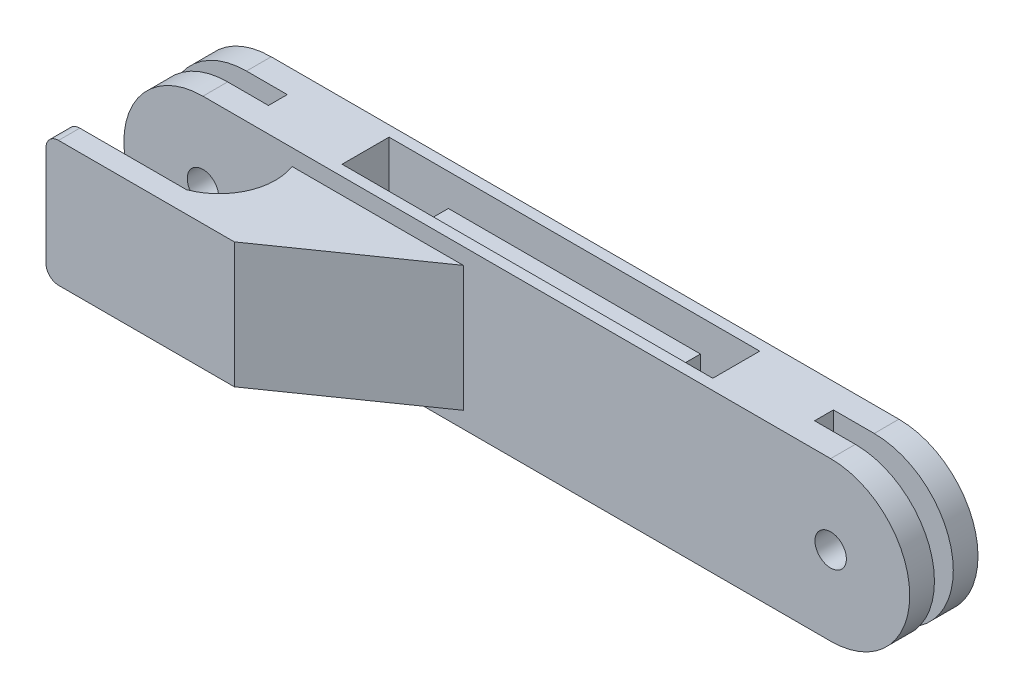
from build123d import *

# Parameters (mm, degrees)
SKETCH1_R           = 3.175
BOSS_EXTRUDE1_DEPTH = 5
SKETCH2_W           = 110.49
SKETCH2_H           = 15
BOSS_EXTRUDE2_DEPTH = 3.81
SKETCH5_R           = 3.175
BOSS_EXTRUDE3_DEPTH = 5
SKETCH6_W           = 75
SKETCH6_H           = 9.5
CUT_EXTRUDE1_DEPTH  = 6.5
SKETCH7_W           = 12
SKETCH7_H           = 9.5
CUT_EXTRUDE2_DEPTH  = 30.48
BOSS_EXTRUDE4_DEPTH = 19.05
CUT_EXTRUDE3_DEPTH  = 30.48
BOSS_EXTRUDE5_DEPTH = 25.4


with BuildPart() as part:
    # Sketch1 → Boss-Extrude1 (new body)
    with BuildSketch(Plane.XY):
        with BuildLine():
            Line((-47.217391304, 7.923913043), (79.782608696, 7.923913043))
            ThreePointArc((79.782608696, 7.923913043), (95.782608696, -8.076086957), (79.782608696, -24.076086957))
            Line((79.782608696, -24.076086957), (-47.217391304, -24.076086957))
            ThreePointArc((-47.217391304, -24.076086957), (-63.217391304, -8.076086957), (-47.217391304, 7.923913043))
        make_face()
        with Locations((-47.217391304, -8.076086957)):
            Circle(SKETCH1_R, mode=Mode.SUBTRACT)
        with Locations((79.782608696, -8.076086957)):
            Circle(SKETCH1_R, mode=Mode.SUBTRACT)
    extrude(amount=BOSS_EXTRUDE1_DEPTH)

    # Sketch2 → Boss-Extrude2 (add)
    with BuildSketch(Plane.XY.offset(5)):
        with Locations((16.282608696, 0.423913043)):
            Rectangle(SKETCH2_W, SKETCH2_H)
    extrude(amount=BOSS_EXTRUDE2_DEPTH)

    # Sketch5 → Boss-Extrude3 (add)
    with BuildSketch(Plane.XY.offset(8.81)):
        with BuildLine():
            Line((-47.217391304, 7.923913043), (79.782608696, 7.923913043))
            ThreePointArc((79.782608696, 7.923913043), (95.782608696, -8.076086957), (79.782608696, -24.076086957))
            Line((79.782608696, -24.076086957), (-47.217391304, -24.076086957))
            ThreePointArc((-47.217391304, -24.076086957), (-63.217391304, -8.076086957), (-47.217391304, 7.923913043))
        make_face()
        with Locations((-47.217391304, -8.076086957)):
            Circle(SKETCH5_R, mode=Mode.SUBTRACT)
        with Locations((79.782608696, -8.076086957)):
            Circle(SKETCH5_R, mode=Mode.SUBTRACT)
    extrude(amount=BOSS_EXTRUDE3_DEPTH)

    # Sketch6 → Cut-Extrude1 (cut)
    with BuildSketch(Plane(origin=(0, 7.923913043, 0), x_dir=(1, 0, 0), z_dir=(0, 1, 0))):
        with Locations((16.282608696, -6.905)):
            Rectangle(SKETCH6_W, SKETCH6_H)
    extrude(amount=-CUT_EXTRUDE1_DEPTH, mode=Mode.SUBTRACT)

    # Sketch7 → Cut-Extrude2 (cut)
    with BuildSketch(Plane(origin=(0, 1.423913043, 0), x_dir=(1, 0, 0), z_dir=(0, 1, 0))):
        with Locations((-15.217391304, -6.905)):
            Rectangle(SKETCH7_W, SKETCH7_H)
        with Locations((47.782608696, -6.905)):
            Rectangle(SKETCH7_W, SKETCH7_H)
    extrude(amount=-CUT_EXTRUDE2_DEPTH, mode=Mode.SUBTRACT)

    # Sketch10 → Boss-Extrude4 (add)
    with BuildSketch(Plane.XY.offset(13.81)):
        with BuildLine():
            Line((-34.517391304, -20.776086957), (-57.377391304, -20.776086957))
            ThreePointArc((-57.377391304, -20.776086957), (-59.173442529, -20.032138181), (-59.917391304, -18.236086957))
            Line((-59.917391304, -18.236086957), (-59.917391304, 2.083913043))
            ThreePointArc((-59.917391304, 2.083913043), (-59.173442529, 3.879964268), (-57.377391304, 4.623913043))
            Line((-57.377391304, 4.623913043), (-34.517391304, 4.623913043))
            Line((-34.517391304, 4.623913043), (-21.817391304, 4.623913043))
            Line((-21.817391304, 4.623913043), (-21.817391304, -20.776086957))
            Line((-21.817391304, -20.776086957), (-34.517391304, -20.776086957))
        make_face()
    extrude(amount=BOSS_EXTRUDE4_DEPTH)

    # Sketch14 → Cut-Extrude3 (cut)
    with BuildSketch(Plane(origin=(0, 4.623913043, 0), x_dir=(1, 0, 0), z_dir=(0, 1, 0))):
        with BuildLine():
            Line((-59.917391304, -13.81), (-29.183391304, -13.81))
            ThreePointArc((-29.183391304, -13.81), (-29.434604535, -22.554535578), (-35.79555952, -28.560221405))
            Line((-35.79555952, -28.560221405), (-59.917391304, -28.560221405))
            Line((-59.917391304, -28.560221405), (-59.917391304, -13.81))
        make_face()
    extrude(amount=-CUT_EXTRUDE3_DEPTH, mode=Mode.SUBTRACT)

    # Sketch15 → Boss-Extrude5 (add)
    with BuildSketch(Plane.XZ.offset(20.776086957)):
        Polygon((-21.817391304, 13.81), (5.46367495, 13.81), (-21.817391304, 32.86), align=None)
    extrude(amount=-BOSS_EXTRUDE5_DEPTH)


solid = part.part
